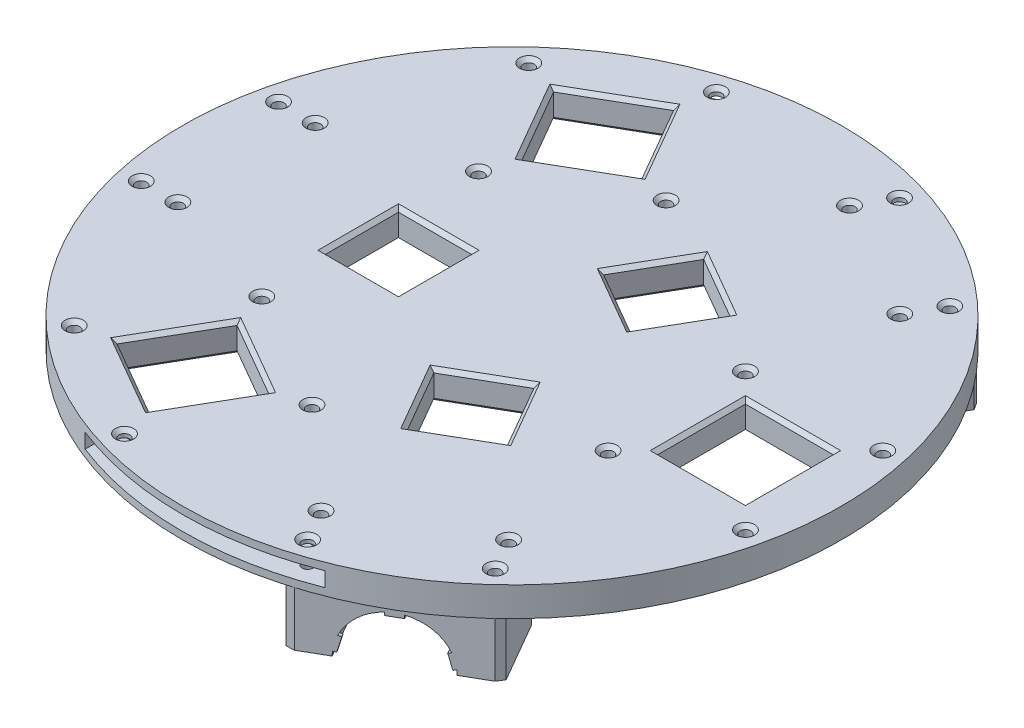
from build123d import *

# Parameters (mm, degrees)
ESBO_O2_R                = 90
RESSALTO_EXTRUS_O1_DEPTH = 8
RESSALTO_EXTRUS_O2_DEPTH = 15
CORTE_EXTRUS_O1_DEPTH    = 14.5
CORTE_EXTRUS_O2_DEPTH    = 14.5
CORTE_EXTRUS_O3_DEPTH    = 183.019916493
CORTE_EXTRUS_O4_DEPTH    = 194.851640839
CORTE_EXTRUS_O5_DEPTH    = 194.851640839
ESBO_O17_R               = 12.5
CORTE_EXTRUS_O6_DEPTH    = 19
ESBO_O18_R               = 12.5
CORTE_EXTRUS_O7_DEPTH    = 19
ESBO_O19_R               = 12.5
CORTE_EXTRUS_O8_DEPTH    = 19
ESBO_O20_R               = 1.5
CORTE_EXTRUS_O9_DEPTH    = 130.340635533
ESBO_O21_R               = 1.5
CORTE_EXTRUS_O10_DEPTH   = 129.16005618
CHANFRO5_SIZE            = 1
CHANFRO6_SIZE            = 1
CHANFRO7_SIZE            = 1
CHANFRO8_SIZE            = 1
CHANFRO9_SIZE            = 1
CHANFRO10_SIZE           = 1


with BuildPart() as part:
    # Esboço2 → Ressalto-extrusão1 (new body)
    with BuildSketch(Plane(origin=(0, 0, 0), x_dir=(1, 0, 0), z_dir=(0, 1, 0))):
        with Locations(Location((0, 0, 0), (0, 0, 270))):
            Circle(ESBO_O2_R)
    extrude(amount=RESSALTO_EXTRUS_O1_DEPTH)

    # Esboço3 → Ressalto-extrusão2 (add)
    with BuildSketch(Plane(origin=(0, 0, 0), x_dir=(-1, 0, 0), z_dir=(0, -1, 0))):
        Polygon((67.5, 0), (67.5, -22), (86.5, -22), (87.5, -20), (87.5, 20), (86.5, 22), (67.5, 22), align=None)
        Polygon((-33.75, 58.456714755), (-14.697441117, 69.456714755), (-24.197441117, 85.911197427), (-26.429491924, 85.777222831), (-61.070508076, 65.777222831), (-62.302558883, 63.911197427), (-52.802558883, 47.456714755), align=None)
        Polygon((-33.75, -58.456714755), (-52.802558883, -47.456714755), (-62.302558883, -63.911197427), (-61.070508076, -65.777222831), (-26.429491924, -85.777222831), (-24.197441117, -85.911197427), (-14.697441117, -69.456714755), align=None)
    extrude(amount=RESSALTO_EXTRUS_O2_DEPTH)

    # Esboço8 → Corte-extrusão1 (cut)
    with BuildSketch(Plane(origin=(0, 0, -90), x_dir=(-1, 0, 0), z_dir=(0, 0, -1))):
        Polygon((0, 2), (32.75, 2), (32.75, 6), (-32.75, 6), (-32.75, 2), align=None)
    extrude(amount=-CORTE_EXTRUS_O1_DEPTH, mode=Mode.SUBTRACT)

    # Esboço9 → Corte-extrusão2 (cut)
    with BuildSketch(Plane.XY.offset(90)):
        Polygon((0, 2), (32.75, 2), (32.75, 6), (-32.75, 6), (-32.75, 2), align=None)
    extrude(amount=-CORTE_EXTRUS_O2_DEPTH, mode=Mode.SUBTRACT)

    # Esboço14 → Corte-extrusão3 (cut, through all)
    with BuildSketch(Plane(origin=(-67.5, 0, 0), x_dir=(0, 0, -1), z_dir=(1, 0, 0))):
        with BuildLine():
            Line((0, -3.5), (-2, -3.5))
            Line((-2, -3.5), (-2, -2.661037321))
            ThreePointArc((-2, -2.661037321), (-7.609517863, -5.083083246), (-11.400884631, -9.874589809))
            Line((-11.400884631, -9.874589809), (-10.590508912, -10.091729329))
            Line((-10.590508912, -10.091729329), (-11.108147002, -12.023580981))
            Line((-11.108147002, -12.023580981), (-11.625785093, -13.955432634))
            Line((-11.625785093, -13.955432634), (-12.436160812, -13.738293114))
            ThreePointArc((-12.436160812, -13.738293114), (0, -27.5), (12.436160812, -13.738293114))
            Line((12.436160812, -13.738293114), (11.625785093, -13.955432634))
            Line((11.625785093, -13.955432634), (11.108147002, -12.023580981))
            Line((11.108147002, -12.023580981), (10.590508912, -10.091729329))
            Line((10.590508912, -10.091729329), (11.400884631, -9.874589809))
            ThreePointArc((11.400884631, -9.874589809), (7.609517863, -5.083083246), (2, -2.661037321))
            Line((2, -2.661037321), (2, -3.5))
            Line((2, -3.5), (0, -3.5))
        make_face()
    extrude(amount=-CORTE_EXTRUS_O3_DEPTH, mode=Mode.SUBTRACT)

    # Esboço15 → Corte-extrusão4 (cut, through all)
    with BuildSketch(Plane(origin=(33.75, 0, 58.456714755), x_dir=(-0.8660254037844385, 0, 0.5000000000000004), z_dir=(-0.5000000000000003, 0, -0.8660254037844384))):
        with BuildLine():
            Line((0, -3.5), (2, -3.5))
            Line((2, -3.5), (2, -2.661037321))
            ThreePointArc((2, -2.661037321), (7.609517863, -5.083083246), (11.400884631, -9.874589809))
            Line((11.400884631, -9.874589809), (10.590508912, -10.091729329))
            Line((10.590508912, -10.091729329), (11.108147002, -12.023580981))
            Line((11.108147002, -12.023580981), (11.625785093, -13.955432634))
            Line((11.625785093, -13.955432634), (12.436160812, -13.738293114))
            ThreePointArc((12.436160812, -13.738293114), (0, -27.5), (-12.436160812, -13.738293114))
            Line((-12.436160812, -13.738293114), (-11.625785093, -13.955432634))
            Line((-11.625785093, -13.955432634), (-11.108147002, -12.023580981))
            Line((-11.108147002, -12.023580981), (-10.590508912, -10.091729329))
            Line((-10.590508912, -10.091729329), (-11.400884631, -9.874589809))
            ThreePointArc((-11.400884631, -9.874589809), (-7.609517863, -5.083083246), (-2, -2.661037321))
            Line((-2, -2.661037321), (-2, -3.5))
            Line((-2, -3.5), (0, -3.5))
        make_face()
    extrude(amount=-CORTE_EXTRUS_O4_DEPTH, mode=Mode.SUBTRACT)

    # Esboço16 → Corte-extrusão5 (cut, through all)
    with BuildSketch(Plane(origin=(33.75, 0, -58.456714755), x_dir=(0.8660254037844386, 0, 0.5), z_dir=(-0.5000000000000001, 0, 0.8660254037844387))):
        with BuildLine():
            Line((0, -3.5), (2, -3.5))
            Line((2, -3.5), (2, -2.661037321))
            ThreePointArc((2, -2.661037321), (7.609517863, -5.083083246), (11.400884631, -9.874589809))
            Line((11.400884631, -9.874589809), (10.590508912, -10.091729329))
            Line((10.590508912, -10.091729329), (11.108147002, -12.023580981))
            Line((11.108147002, -12.023580981), (11.625785093, -13.955432634))
            Line((11.625785093, -13.955432634), (12.436160812, -13.738293114))
            ThreePointArc((12.436160812, -13.738293114), (0, -27.5), (-12.436160812, -13.738293114))
            Line((-12.436160812, -13.738293114), (-11.625785093, -13.955432634))
            Line((-11.625785093, -13.955432634), (-11.108147002, -12.023580981))
            Line((-11.108147002, -12.023580981), (-10.590508912, -10.091729329))
            Line((-10.590508912, -10.091729329), (-11.400884631, -9.874589809))
            ThreePointArc((-11.400884631, -9.874589809), (-7.609517863, -5.083083246), (-2, -2.661037321))
            Line((-2, -2.661037321), (-2, -3.5))
            Line((-2, -3.5), (0, -3.5))
        make_face()
    extrude(amount=-CORTE_EXTRUS_O5_DEPTH, mode=Mode.SUBTRACT)

    # Esboço17 → Corte-extrusão6 (cut)
    with BuildSketch(Plane(origin=(33.75, 0, 58.456714755), x_dir=(-0.8660254037844385, 0, 0.5000000000000004), z_dir=(-0.5000000000000003, 0, -0.8660254037844384))):
        with Locations((0, -15)):
            Circle(ESBO_O17_R)
    extrude(amount=-CORTE_EXTRUS_O6_DEPTH, mode=Mode.SUBTRACT)

    # Esboço18 → Corte-extrusão7 (cut)
    with BuildSketch(Plane(origin=(-67.5, 0, 0), x_dir=(0, 0, -1), z_dir=(1, 0, 0))):
        with Locations((0, -15)):
            Circle(ESBO_O18_R)
    extrude(amount=-CORTE_EXTRUS_O7_DEPTH, mode=Mode.SUBTRACT)

    # Esboço19 → Corte-extrusão8 (cut)
    with BuildSketch(Plane(origin=(33.75, 0, -58.456714755), x_dir=(0.8660254037844386, 0, 0.5), z_dir=(-0.5000000000000001, 0, 0.8660254037844387))):
        with Locations((0, -15)):
            Circle(ESBO_O19_R)
    extrude(amount=-CORTE_EXTRUS_O8_DEPTH, mode=Mode.SUBTRACT)

    # Esboço20 → Corte-extrusão9 (cut, through all)
    with BuildSketch(Plane.XZ.offset(15)):
        with Locations(Location((-82.5, 18.75, 0), (0, 0, 270))):
            Circle(ESBO_O20_R)
        with Locations(Location((-72.5, 18.75, 0), (0, 0, 270))):
            Circle(ESBO_O20_R)
        with Locations(Location((-82.5, -18.75, 0), (0, 0, 270))):
            Circle(ESBO_O20_R)
        with Locations(Location((-72.5, -18.75, 0), (0, 0, 270))):
            Circle(ESBO_O20_R)
        with Locations(Location((25.012023679, -80.822095812, 0), (0, 0, 270))):
            Circle(ESBO_O20_R)
        with Locations(Location((20.012023679, -72.161841774, 0), (0, 0, 270))):
            Circle(ESBO_O20_R)
        with Locations(Location((57.487976321, -62.072095812, 0), (0, 0, 270))):
            Circle(ESBO_O20_R)
        with Locations(Location((52.487976321, -53.411841774, 0), (0, 0, 270))):
            Circle(ESBO_O20_R)
        with Locations(Location((57.487976321, 62.072095812, 0), (0, 0, 270))):
            Circle(ESBO_O20_R)
        with Locations(Location((52.487976321, 53.411841774, 0), (0, 0, 270))):
            Circle(ESBO_O20_R)
        with Locations(Location((25.012023679, 80.822095812, 0), (0, 0, 270))):
            Circle(ESBO_O20_R)
        with Locations(Location((20.012023679, 72.161841774, 0), (0, 0, 270))):
            Circle(ESBO_O20_R)
    extrude(amount=-CORTE_EXTRUS_O9_DEPTH, mode=Mode.SUBTRACT)

    # Esboço21 → Corte-extrusão10 (cut, through all)
    with BuildSketch(Plane(origin=(0, 0, 0), x_dir=(-1, 0, 0), z_dir=(0, -1, 0))):
        with Locations(Location((-45, -18.75, 0), (0, 0, 90))):
            Circle(ESBO_O21_R)
        with Locations(Location((-82.5, -18.75, 0), (0, 0, 90))):
            Circle(ESBO_O21_R)
        with Locations(Location((-82.5, 18.75, 0), (0, 0, 90))):
            Circle(ESBO_O21_R)
        with Locations(Location((-45, 18.75, 0), (0, 0, 90))):
            Circle(ESBO_O21_R)
        with Locations(Location((38.737976321, -29.59614317, 0), (0, 0, 90))):
            Circle(ESBO_O21_R)
        with Locations(Location((57.487976321, -62.072095812, 0), (0, 0, 90))):
            Circle(ESBO_O21_R)
        with Locations(Location((25.012023679, -80.822095812, 0), (0, 0, 90))):
            Circle(ESBO_O21_R)
        with Locations(Location((6.262023679, -48.34614317, 0), (0, 0, 90))):
            Circle(ESBO_O21_R)
        with Locations(Location((6.262023679, 48.34614317, 0), (0, 0, 90))):
            Circle(ESBO_O21_R)
        with Locations(Location((25.012023679, 80.822095812, 0), (0, 0, 90))):
            Circle(ESBO_O21_R)
        with Locations(Location((57.487976321, 62.072095812, 0), (0, 0, 90))):
            Circle(ESBO_O21_R)
        with Locations(Location((38.737976321, 29.59614317, 0), (0, 0, 90))):
            Circle(ESBO_O21_R)
        Polygon((-10.5, 18.186533479), (-1.839745962, 23.186533479), (-11.839745962, 40.507041555), (-29.160254038, 30.507041555), (-19.160254038, 13.186533479), align=None)
        Polygon((21, 0), (21, -10), (41, -10), (41, 10), (21, 10), align=None)
        Polygon((-51.75, 0), (-51.75, -12), (-75.75, -12), (-75.75, 12), (-51.75, 12), align=None)
        Polygon((25.875, -44.816814646), (36.267304845, -38.816814646), (48.267304845, -59.601424337), (27.482695155, -71.601424337), (15.482695155, -50.816814646), align=None)
        Polygon((-10.5, -18.186533479), (-19.160254038, -13.186533479), (-29.160254038, -30.507041555), (-11.839745962, -40.507041555), (-1.839745962, -23.186533479), align=None)
        Polygon((25.875, 44.816814646), (15.482695155, 50.816814646), (27.482695155, 71.601424337), (48.267304845, 59.601424337), (36.267304845, 38.816814646), align=None)
    extrude(amount=-CORTE_EXTRUS_O10_DEPTH, mode=Mode.SUBTRACT)

    # Chanfro5
    chanfro5_edges = [part.edges().sort_by_distance(p)[0] for p in [
        (57.487976321, 8, 63.572095812),
        (52.487976321, 8, -51.911841774),
        (57.487976321, 8, -60.572095812),
        (20.012023679, 8, -70.661841774),
        (-72.5, 8, 20.25),
        (25.012023679, 8, -79.322095812),
        (-82.5, 8, -17.25),
        (-72.5, 8, -17.25),
        (52.487976321, 8, 54.911841774),
        (25.012023679, 8, 82.322095812),
        (20.012023679, 8, 73.661841774),
        (-82.5, 8, 20.25),
        (-6.262023679, 8, -46.84614317),
        (-25.012023679, 8, -79.322095812),
        (-57.487976321, 8, -60.572095812),
        (-6.262023679, 8, 49.84614317),
        (-25.012023679, 8, 82.322095812),
        (-57.487976321, 8, 63.572095812),
        (45, 8, 20.25),
        (82.5, 8, 20.25),
        (82.5, 8, -17.25),
        (45, 8, -17.25),
        (-38.737976321, 8, 31.09614317),
        (-38.737976321, 8, -28.09614317),
    ]]
    chamfer(chanfro5_edges, length=CHANFRO5_SIZE)

    # Chanfro6
    chanfro6_edges = [part.edges().sort_by_distance(p)[0] for p in [
        (-25.875, 8, -44.816814646),
        (-21.482695155, 8, -61.209119491),
        (-37.875, 8, -65.601424337),
        (-42.267304845, 8, -49.209119491),
        (6.839745962, 8, 31.846787517),
        (20.5, 8, 35.507041555),
        (24.160254038, 8, 21.846787517),
        (10.5, 8, 18.186533479),
        (51.75, 8, 0),
        (63.75, 8, 12),
        (75.75, 8, 0),
        (63.75, 8, -12),
        (24.160254038, 8, -21.846787517),
        (20.5, 8, -35.507041555),
        (6.839745962, 8, -31.846787517),
        (10.5, 8, -18.186533479),
        (-25.875, 8, 44.816814646),
        (-42.267304845, 8, 49.209119491),
        (-37.875, 8, 65.601424337),
        (-21.482695155, 8, 61.209119491),
        (-31, 8, -10),
        (-41, 8, 0),
        (-31, 8, 10),
        (-21, 8, 0),
    ]]
    chamfer(chanfro6_edges, length=CHANFRO6_SIZE)

    # Chanfro7
    chanfro7_edges = [part.edges().sort_by_distance(p)[0] for p in [
        (-72.5, -15, 20.25),
        (-82.5, -15, -17.25),
        (-72.5, -15, -17.25),
        (-82.5, -15, 20.25),
    ]]
    chamfer(chanfro7_edges, length=CHANFRO7_SIZE)

    # Chanfro8
    chanfro8_edges = [part.edges().sort_by_distance(p)[0] for p in [
        (-6.262023679, 0, -46.84614317),
        (-25.012023679, 0, -79.322095812),
        (-57.487976321, 0, -60.572095812),
        (-6.262023679, 0, 49.84614317),
        (-25.012023679, 0, 82.322095812),
        (-57.487976321, 0, 63.572095812),
        (45, 0, 20.25),
        (82.5, 0, 20.25),
        (82.5, 0, -17.25),
        (45, 0, -17.25),
        (-38.737976321, 0, 31.09614317),
        (-38.737976321, 0, -28.09614317),
    ]]
    chamfer(chanfro8_edges, length=CHANFRO8_SIZE)

    # Chanfro9
    chanfro9_edges = [part.edges().sort_by_distance(p)[0] for p in [
        (57.487976321, -15, 63.572095812),
        (52.487976321, -15, -51.911841774),
        (57.487976321, -15, -60.572095812),
        (20.012023679, -15, -70.661841774),
        (25.012023679, -15, -79.322095812),
        (52.487976321, -15, 54.911841774),
        (25.012023679, -15, 82.322095812),
        (20.012023679, -15, 73.661841774),
    ]]
    chamfer(chanfro9_edges, length=CHANFRO9_SIZE)

    # Chanfro10
    chanfro10_edges = [part.edges().sort_by_distance(p)[0] for p in [
        (-25.875, 0, -44.816814646),
        (-42.267304845, 0, -49.209119491),
        (-37.875, 0, -65.601424337),
        (-21.482695155, 0, -61.209119491),
        (6.839745962, 0, 31.846787517),
        (10.5, 0, 18.186533479),
        (24.160254038, 0, 21.846787517),
        (20.5, 0, 35.507041555),
        (51.75, 0, 0),
        (63.75, 0, -12),
        (75.75, 0, 0),
        (63.75, 0, 12),
        (24.160254038, 0, -21.846787517),
        (10.5, 0, -18.186533479),
        (6.839745962, 0, -31.846787517),
        (20.5, 0, -35.507041555),
        (-25.875, 0, 44.816814646),
        (-21.482695155, 0, 61.209119491),
        (-37.875, 0, 65.601424337),
        (-42.267304845, 0, 49.209119491),
        (-31, 0, -10),
        (-21, 0, 0),
        (-31, 0, 10),
        (-41, 0, 0),
    ]]
    chamfer(chanfro10_edges, length=CHANFRO10_SIZE)


solid = part.part
